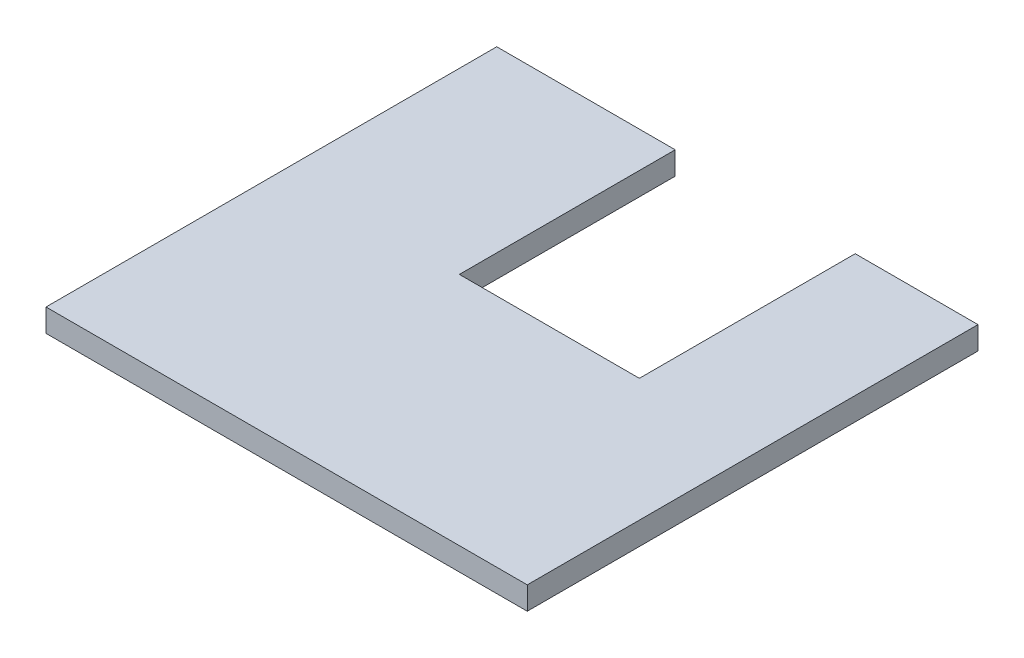
from build123d import *

# Parameters (mm, degrees)
BOSS_EXTRUDE1_DEPTH = 3


with BuildPart() as part:
    # Sketch3 → Boss-Extrude1 (new body)
    with BuildSketch(Plane(origin=(0, 0, 0), x_dir=(1, 0, 0), z_dir=(0, 1, 0))):
        Polygon((23.6, 0), (0, 0), (0, 28.3), (-23.4, 28.3), (-23.4, -30.8), (39.7, -30.8), (39.7, 28.3), (23.6, 28.3), align=None)
    extrude(amount=BOSS_EXTRUDE1_DEPTH)


solid = part.part
